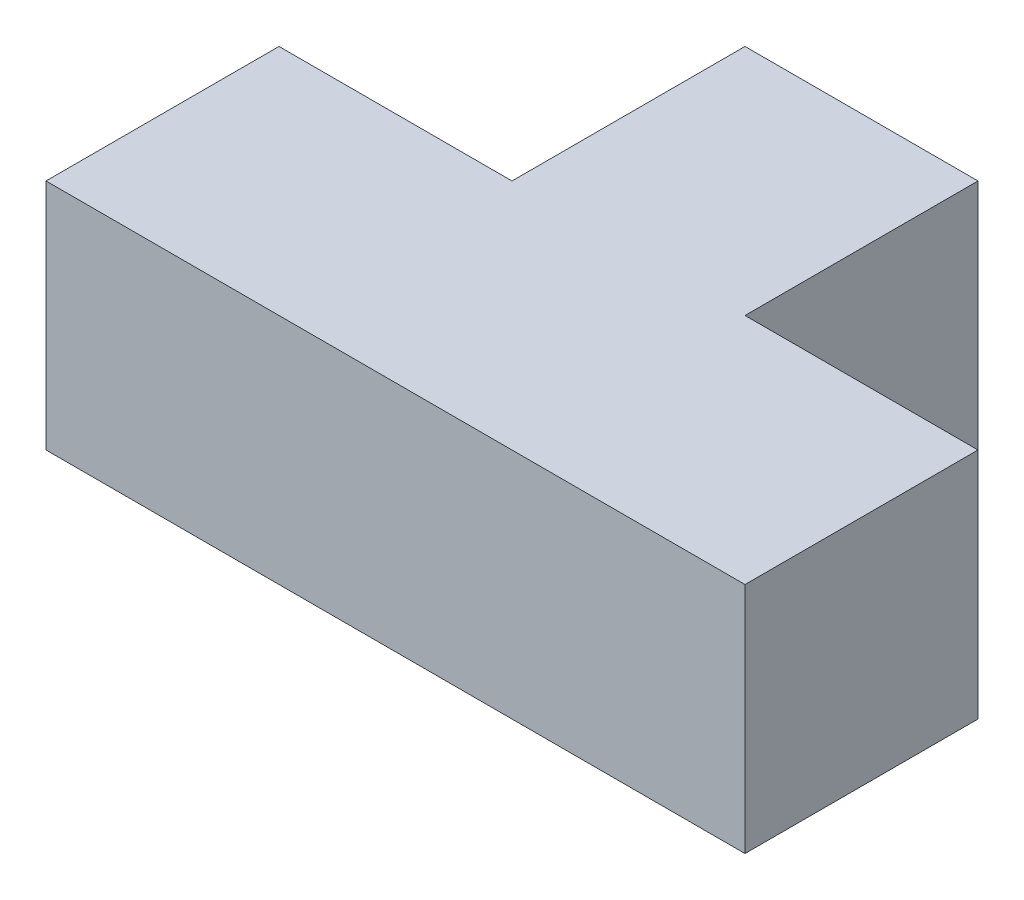
from build123d import *

# Parameters (mm, degrees)
EXTRUDE_1_DEPTH = 100
SKETCH_3_W      = 100
SKETCH_3_H      = 100
EXTRUDE_3_DEPTH = 100


with BuildPart() as part:
    # 草图1 → 凸台-拉伸1 (new body)
    with BuildSketch(Plane(origin=(0, 0, 0), x_dir=(1, 0, 0), z_dir=(0, 1, 0))):
        Polygon((0, 0), (200, 0), (200, 100), (100, 100), (100, 200), (0, 200), align=None)
    extrude(amount=EXTRUDE_1_DEPTH)

    # 草图3 → 凸台-拉伸3 (add)
    with BuildSketch(Plane.ZY):
        with Locations((-50, 50)):
            Rectangle(SKETCH_3_W, SKETCH_3_H)
    extrude(amount=EXTRUDE_3_DEPTH)


solid = part.part
